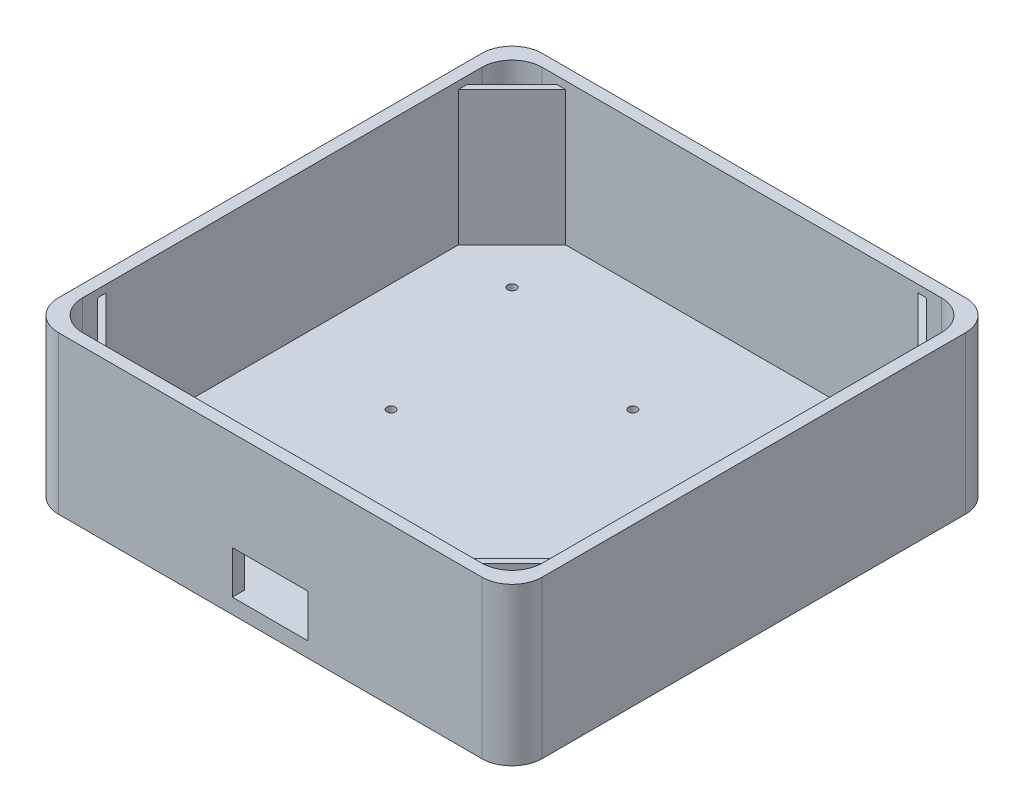
from build123d import *

# Parameters (mm, degrees)
SKETCH1_W           = 160
SKETCH1_H           = 160
SKETCH1_W_2         = 152
SKETCH1_H_2         = 152
BOSS_EXTRUDE1_DEPTH = 52
SKETCH2_W           = 160
SKETCH2_H           = 160
BOSS_EXTRUDE2_DEPTH = 5
SKETCH3_R           = 1.42
CUT_EXTRUDE1_DEPTH  = 10
SKETCH4_W           = 152
SKETCH4_H           = 152
CUT_EXTRUDE2_DEPTH  = 2.5
FILLET1_R           = 10
FILLET2_R           = 10
SKETCH5_R           = 3
CUT_EXTRUDE3_DEPTH  = 2
SKETCH7_W           = 25
SKETCH7_H           = 14.209603119
CUT_EXTRUDE4_DEPTH  = 10


with BuildPart() as part:
    # Sketch1 → Boss-Extrude1 (new body)
    # profile 1 of 5: a face of its own
    with BuildSketch(Plane(origin=(0, 0, 0), x_dir=(1, 0, 0), z_dir=(0, 1, 0))):
        Rectangle(SKETCH1_W, SKETCH1_H)
        Rectangle(SKETCH1_W_2, SKETCH1_H_2, mode=Mode.SUBTRACT)
    # profile 2 of 5: a face of its own
    with BuildSketch(Plane(origin=(0, 0, 0), x_dir=(1, 0, 0), z_dir=(0, 1, 0))):
        Polygon((-61.150757595, 76), (-76, 61.150757595), (-76, 58.32233047), (-58.32233047, 76), align=None)
    # profile 3 of 5: a face of its own
    with BuildSketch(Plane(origin=(0, 0, 0), x_dir=(1, 0, 0), z_dir=(0, 1, 0))):
        Polygon((-58.32233047, -76), (-76, -58.32233047), (-76, -61.150757595), (-61.150757595, -76), align=None)
    # profile 4 of 5: a face of its own
    with BuildSketch(Plane(origin=(0, 0, 0), x_dir=(1, 0, 0), z_dir=(0, 1, 0))):
        Polygon((76, -58.32233047), (58.32233047, -76), (61.150757595, -76), (76, -61.150757595), align=None)
    # profile 5 of 5: a face of its own
    with BuildSketch(Plane(origin=(0, 0, 0), x_dir=(1, 0, 0), z_dir=(0, 1, 0))):
        Polygon((61.150757595, 76), (58.32233047, 76), (76, 58.32233047), (76, 61.150757595), align=None)
    extrude(amount=BOSS_EXTRUDE1_DEPTH)

    # Sketch2 → Boss-Extrude2 (add)
    with BuildSketch(Plane(origin=(0, 0, 0), x_dir=(1, 0, 0), z_dir=(0, 1, 0))):
        Rectangle(SKETCH2_W, SKETCH2_H)
    extrude(amount=BOSS_EXTRUDE2_DEPTH)

    # Sketch3 → Cut-Extrude1 (cut)
    with BuildSketch(Plane(origin=(0, 5, 0), x_dir=(1, 0, 0), z_dir=(0, 1, 0))):
        with Locations(Location((-55, 55, 0), (0, 0, 270))):
            Circle(SKETCH3_R)
        with Locations(Location((55, 55, 0), (0, 0, 270))):
            Circle(SKETCH3_R)
        with Locations(Location((55, -55, 0), (0, 0, 270))):
            Circle(SKETCH3_R)
        with Locations(Location((-55, -55, 0), (0, 0, 270))):
            Circle(SKETCH3_R)
        with Locations(Location((0, 40, 0), (0, 0, 270))):
            Circle(SKETCH3_R)
        with Locations(Location((40, 0, 0), (0, 0, 270))):
            Circle(SKETCH3_R)
        with Locations(Location((0, -40, 0), (0, 0, 270))):
            Circle(SKETCH3_R)
        with Locations(Location((-40, 0, 0), (0, 0, 270))):
            Circle(SKETCH3_R)
    extrude(amount=-CUT_EXTRUDE1_DEPTH, mode=Mode.SUBTRACT)

    # Sketch4 → Cut-Extrude2 (cut)
    with BuildSketch(Plane(origin=(0, 52, 0), x_dir=(1, 0, 0), z_dir=(0, 1, 0))):
        Rectangle(SKETCH4_W, SKETCH4_H)
    extrude(amount=-CUT_EXTRUDE2_DEPTH, mode=Mode.SUBTRACT)

    # Fillet1
    fillet1_edges = [part.edges().sort_by_distance(p)[0] for p in [
        (-80, 26, 80),
        (-80, 26, -80),
        (80, 26, -80),
        (80, 26, 80),
    ]]
    fillet(fillet1_edges, radius=FILLET1_R)

    # Fillet2
    fillet2_edges = [part.edges().sort_by_distance(p)[0] for p in [
        (-76, 28.5, 76),
        (-76, 28.5, -76),
        (76, 28.5, 76),
        (76, 28.5, -76),
    ]]
    fillet(fillet2_edges, radius=FILLET2_R)

    # Sketch5 → Cut-Extrude3 (cut)
    with BuildSketch(Plane.XZ):
        with Locations(Location((-55, 55, 0), (0, 0, 270))):
            Circle(SKETCH5_R)
        with Locations(Location((55, 55, 0), (0, 0, 270))):
            Circle(SKETCH5_R)
        with Locations(Location((55, -55, 0), (0, 0, 270))):
            Circle(SKETCH5_R)
        with Locations(Location((-55, -55, 0), (0, 0, 270))):
            Circle(SKETCH5_R)
        with Locations(Location((0, 40, 0), (0, 0, 270))):
            Circle(SKETCH5_R)
        with Locations(Location((-40, 0, 0), (0, 0, 270))):
            Circle(SKETCH5_R)
        with Locations(Location((0, -40, 0), (0, 0, 270))):
            Circle(SKETCH5_R)
        with Locations(Location((40, 0, 0), (0, 0, 270))):
            Circle(SKETCH5_R)
    extrude(amount=-CUT_EXTRUDE3_DEPTH, mode=Mode.SUBTRACT)

    # Sketch7 → Cut-Extrude4 (cut)
    with BuildSketch(Plane.XY.offset(80)):
        with Locations((0, 12.10480156)):
            Rectangle(SKETCH7_W, SKETCH7_H)
    extrude(amount=-CUT_EXTRUDE4_DEPTH, mode=Mode.SUBTRACT)


solid = part.part
